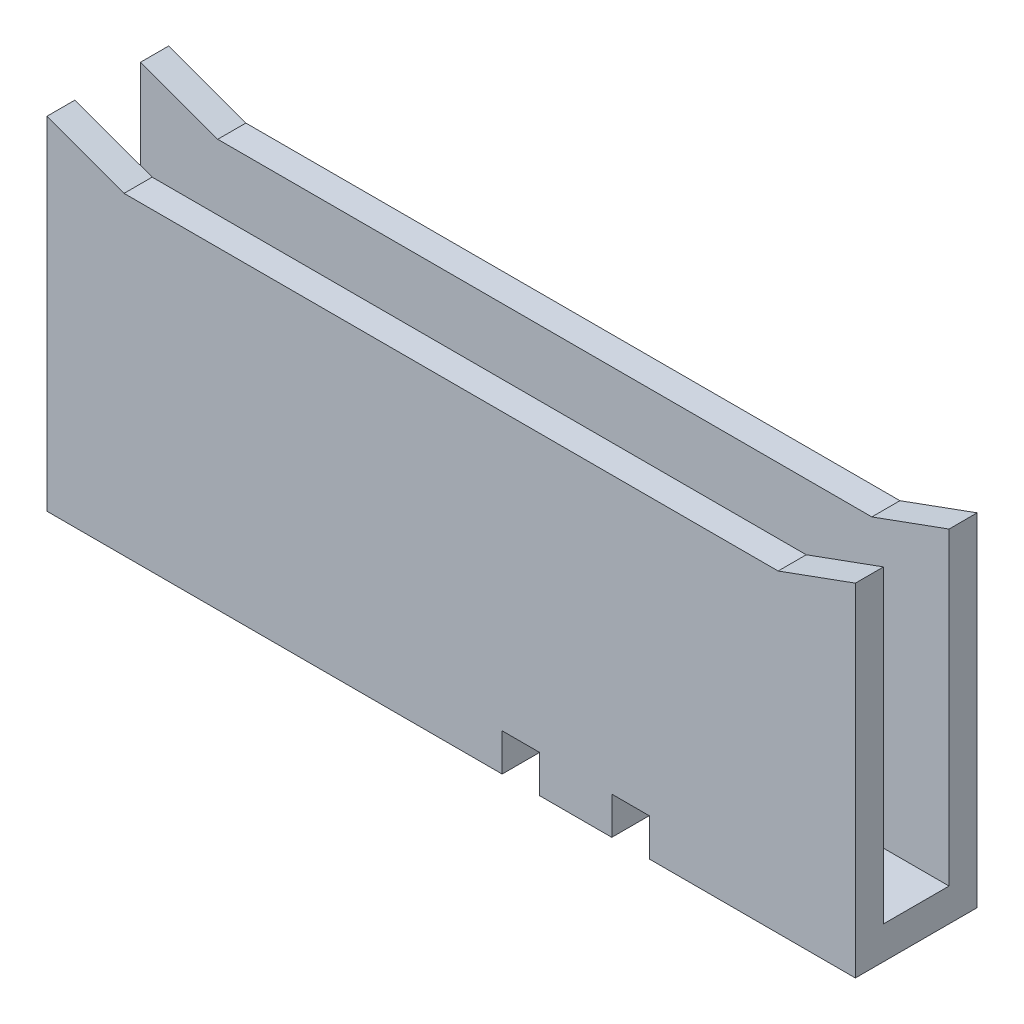
from build123d import *

# Parameters (mm, degrees)
SKETCH_1_W          = 86.3
SKETCH_1_H          = 33.5
EXTRUDE_1_DEPTH     = 13
EXTRUDE_2_DEPTH     = 13
SKETCH_7_W          = 86.3
SKETCH_7_H          = 7
CUT_EXTRUDE_3_DEPTH = 3
SKETCH_8_W          = 86.3
SKETCH_8_H          = 7
CUT_EXTRUDE_4_DEPTH = 30
SKETCH_9_R          = 0.975
CUT_EXTRUDE_5_DEPTH = 58.992865941
SKETCH_10_W         = 4
SKETCH_10_H         = 4
CUT_EXTRUDE_6_DEPTH = 50.203505973


with BuildPart() as part:
    # ｽｹｯﾁ1 → ﾎﾞｽ - 押し出し1 (new body)
    with BuildSketch(Plane.XY):
        Rectangle(SKETCH_1_W, SKETCH_1_H)
    extrude(amount=EXTRUDE_1_DEPTH)

    # ｽｹｯﾁ3 → ﾎﾞｽ - 押し出し2 (add)
    with BuildSketch(Plane(origin=(0, 0, 0), x_dir=(-1, 0, 0), z_dir=(0, 0, -1))):
        Polygon((-43.15, 16.75), (-43.15, 19.75), (-34.907567742, 16.75), align=None)
        Polygon((43.15, 16.75), (43.15, 19.75), (34.907567742, 16.75), align=None)
    extrude(amount=-EXTRUDE_2_DEPTH)

    # ｽｹｯﾁ7 → ｶｯﾄ - 押し出し3 (cut)
    with BuildSketch(Plane(origin=(0, 16.75, 0), x_dir=(1, 0, 0), z_dir=(0, 1, 0))):
        with Locations((0, -6.5)):
            Rectangle(SKETCH_7_W, SKETCH_7_H)
    extrude(amount=CUT_EXTRUDE_3_DEPTH, mode=Mode.SUBTRACT)

    # ｽｹｯﾁ8 → ｶｯﾄ - 押し出し4 (cut)
    with BuildSketch(Plane(origin=(0, 16.75, 0), x_dir=(1, 0, 0), z_dir=(0, 1, 0))):
        with Locations((0, -6.5)):
            Rectangle(SKETCH_8_W, SKETCH_8_H)
    extrude(amount=-CUT_EXTRUDE_4_DEPTH, mode=Mode.SUBTRACT)

    # ｽｹｯﾁ9 → ｶｯﾄ - 押し出し5 (cut, through all)
    with BuildSketch(Plane.XZ.offset(16.75)):
        with Locations((-38.15, 6.5)):
            Circle(SKETCH_9_R)
        with Locations((38.15, 6.5)):
            Circle(SKETCH_9_R)
    extrude(amount=-CUT_EXTRUDE_5_DEPTH, mode=Mode.SUBTRACT)

    # ｽｹｯﾁ10 → ｶｯﾄ - 押し出し6 (cut, through all)
    with BuildSketch(Plane.XY.offset(13)):
        with Locations((7.45, -14.75)):
            Rectangle(SKETCH_10_W, SKETCH_10_H)
        with Locations((19.15, -14.75)):
            Rectangle(SKETCH_10_W, SKETCH_10_H)
    extrude(amount=-CUT_EXTRUDE_6_DEPTH, mode=Mode.SUBTRACT)


solid = part.part
